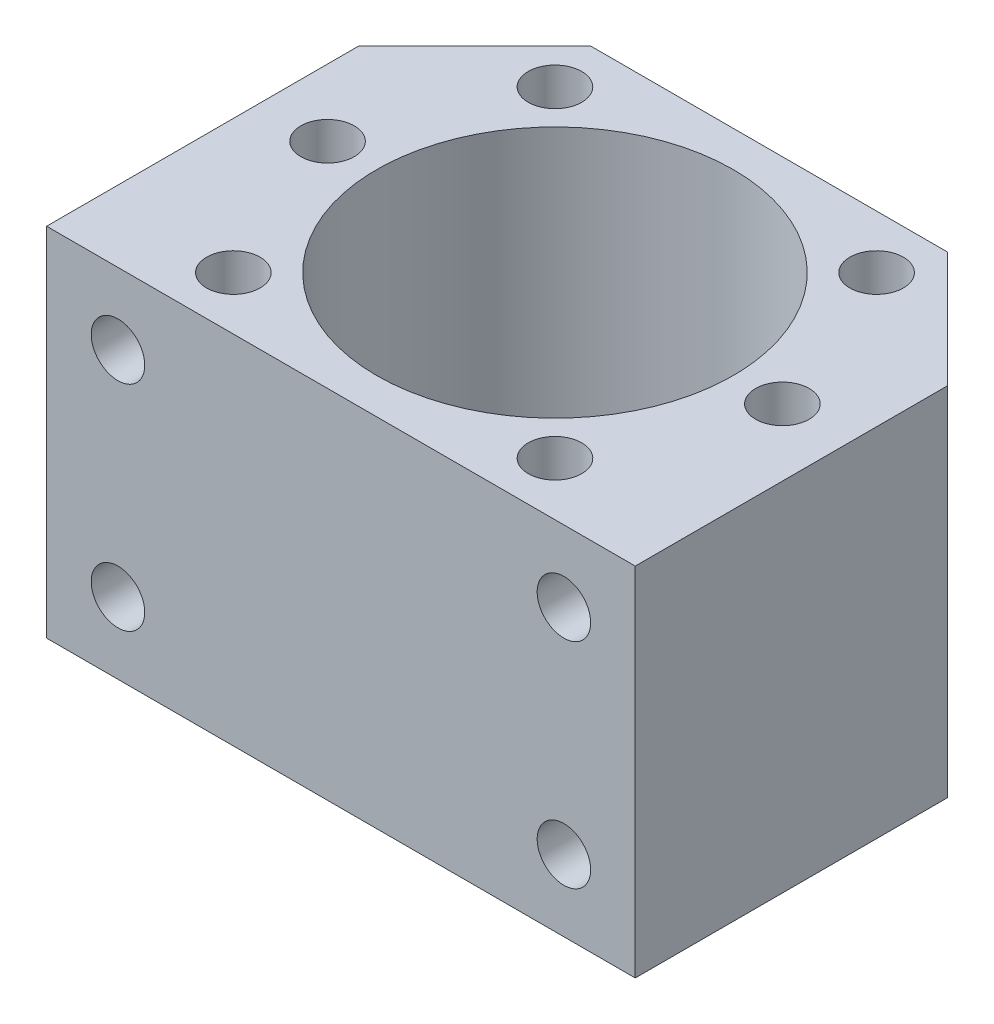
from build123d import *

# Parameters (mm, degrees)
SKETCH_1_R          = 20
SKETCH_1_R_2        = 3
EXTRUDE_1_DEPTH     = 40
SKETCH_2_R          = 3
CUT_EXTRUDE_1_DEPTH = 15


with BuildPart() as part:
    # 草图1 → 凸台-拉伸1 (new body)
    with BuildSketch(Plane(origin=(0, 0, 0), x_dir=(1, 0, 0), z_dir=(0, 1, 0))):
        Polygon((-33, -24), (33, -24), (33, 11), (20, 24), (-20, 24), (-33, 11), align=None)
        with Locations(Location((0, 0, 0), (0, 0, 270))):
            Circle(SKETCH_1_R, mode=Mode.SUBTRACT)
        with Locations(Location((-25.5, 0, 0), (0, 0, 270))):
            Circle(SKETCH_1_R_2, mode=Mode.SUBTRACT)
        with Locations(Location((-18.03122292, 18.03122292, 0), (0, 0, 270))):
            Circle(SKETCH_1_R_2, mode=Mode.SUBTRACT)
        with Locations(Location((-18.03122292, -18.03122292, 0), (0, 0, 270))):
            Circle(SKETCH_1_R_2, mode=Mode.SUBTRACT)
        with Locations(Location((18.03122292, -18.03122292, 0), (0, 0, 90))):
            Circle(SKETCH_1_R_2, mode=Mode.SUBTRACT)
        with Locations(Location((18.03122292, 18.03122292, 0), (0, 0, 90))):
            Circle(SKETCH_1_R_2, mode=Mode.SUBTRACT)
        with Locations(Location((25.5, 0, 0), (0, 0, 90))):
            Circle(SKETCH_1_R_2, mode=Mode.SUBTRACT)
    extrude(amount=EXTRUDE_1_DEPTH)

    # 草图2 → 切除-拉伸1 (cut)
    with BuildSketch(Plane.XY.offset(24)):
        with Locations((-25, 32)):
            Circle(SKETCH_2_R)
        with Locations((-25, 8)):
            Circle(SKETCH_2_R)
        with Locations(Location((25, 8, 0), (0, 0, 180))):
            Circle(SKETCH_2_R)
        with Locations(Location((25, 32, 0), (0, 0, 180))):
            Circle(SKETCH_2_R)
    extrude(amount=-CUT_EXTRUDE_1_DEPTH, mode=Mode.SUBTRACT)


solid = part.part
